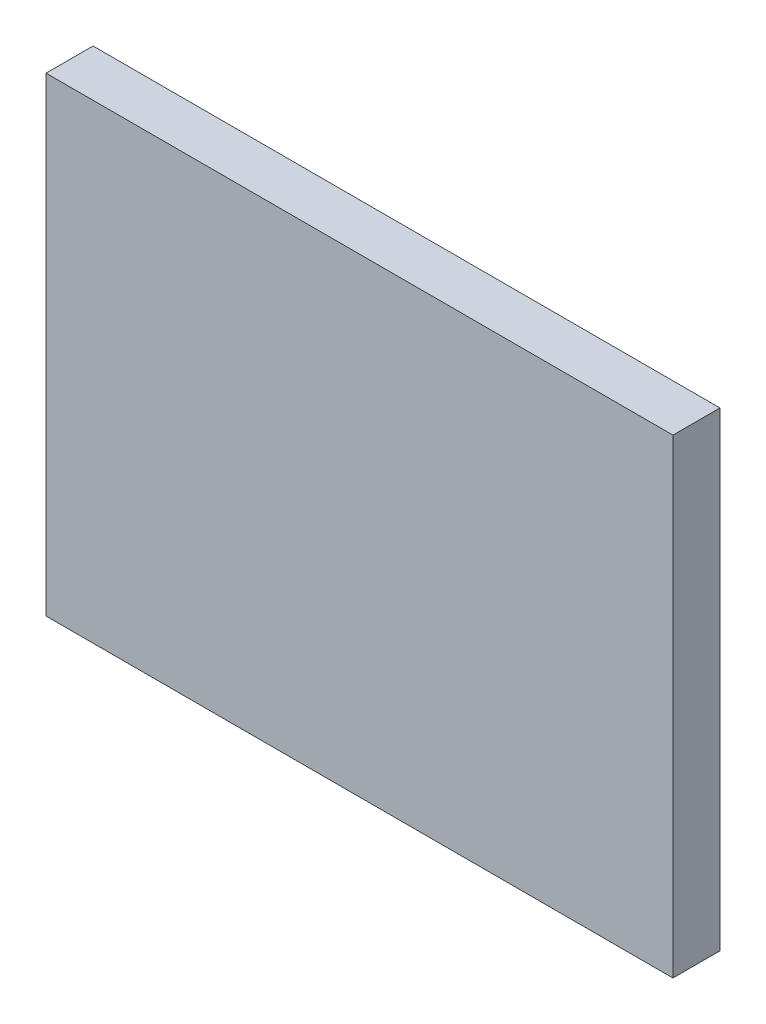
from build123d import *

# Parameters (mm, degrees)
SKETCH_1_W      = 40
SKETCH_1_H      = 30
EXTRUDE_1_DEPTH = 3


with BuildPart() as part:
    # 草图1 → 凸台-拉伸1 (new body)
    with BuildSketch(Plane.XY):
        Rectangle(SKETCH_1_W, SKETCH_1_H)
    extrude(amount=EXTRUDE_1_DEPTH)


solid = part.part
